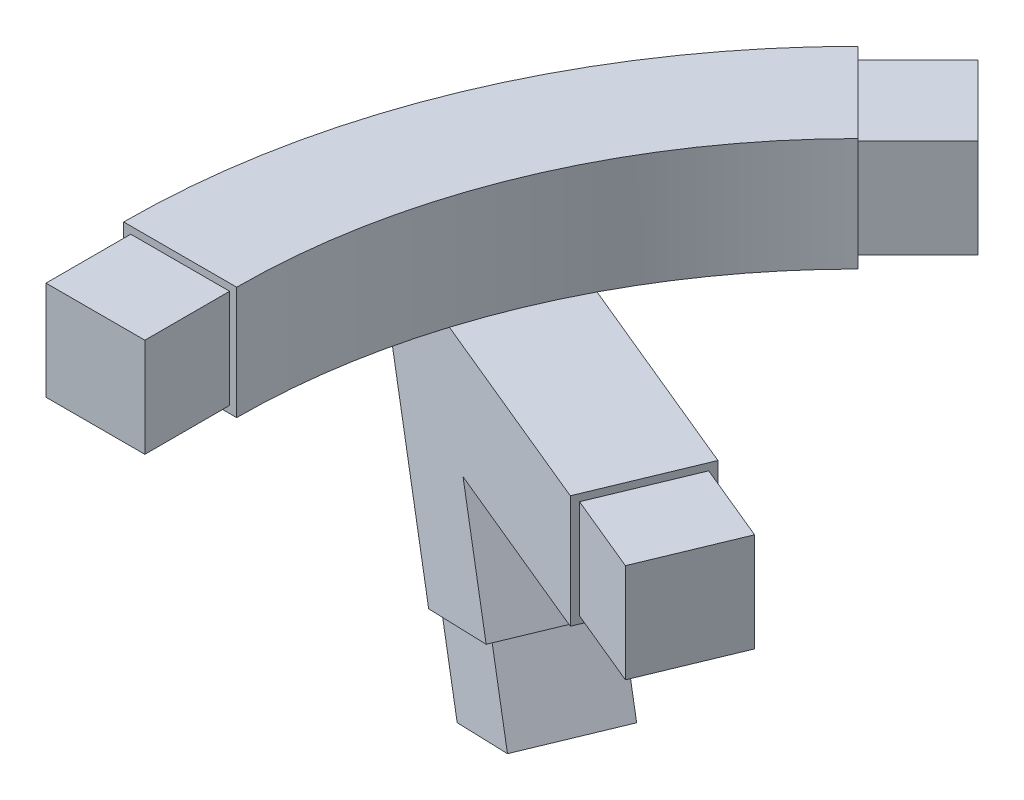
from build123d import *

# Parameters (mm, degrees)
BOSS_EXTRUDE1_DEPTH = 25.4
BOSS_EXTRUDE2_DEPTH = 12.7
SKETCH3_W           = 22.225
SKETCH3_H           = 22.225
BOSS_EXTRUDE3_DEPTH = 19.05
SKETCH4_W           = 22.225
SKETCH4_H           = 22.225
BOSS_EXTRUDE4_DEPTH = 19.05
SKETCH5_W           = 22.225
SKETCH5_H           = 22.225
BOSS_EXTRUDE5_DEPTH = 19.05
BOSS_EXTRUDE6_DEPTH = 19.05
CUT_EXTRUDE1_DEPTH  = 580.024222363


with BuildPart() as part:
    # Sketch1 → Boss-Extrude1 (new body)
    with BuildSketch(Plane(origin=(0, 0, 0), x_dir=(1, 0, 0), z_dir=(0, 1, 0))):
        with BuildLine():
            ThreePointArc((-476.965634664, 139.7), (-466.331605355, 193.160875501), (-436.048451995, 238.482817332))
            Line((-436.048451995, 238.482817332), (-454.008964237, 256.443329574))
            ThreePointArc((-454.008964237, 256.443329574), (-489.798145481, 202.881034683), (-502.365634664, 139.7))
            Line((-502.365634664, 139.7), (-476.965634664, 139.7))
        make_face()
    extrude(amount=BOSS_EXTRUDE1_DEPTH)

    # Sketch2 → Boss-Extrude2 (add, symmetric)
    with BuildSketch(Plane(origin=(0, 0, 0), x_dir=(0.9238795325112892, 0, 0.3826834323650839), z_dir=(-0.3826834323650839, 0, 0.9238795325112892))):
        Polygon((-530.153692386, 0), (-530.153692386, -12.7), (-512.779069106, -60.436385136), (-488.910876538, -51.749073495), (-498.50115499, -25.4), (-453.953692386, -25.4), (-453.953692386, 0), align=None)
    extrude(amount=BOSS_EXTRUDE2_DEPTH, both=True)

    # Sketch3 → Boss-Extrude3 (add)
    with BuildSketch(Plane.XY.offset(-139.7)):
        with Locations((-489.665634664, 12.7)):
            Rectangle(SKETCH3_W, SKETCH3_H)
    extrude(amount=BOSS_EXTRUDE3_DEPTH)

    # Sketch4 → Boss-Extrude4 (add)
    with BuildSketch(Plane(origin=(-98.782817332, 0, 98.782817332), x_dir=(-0.7071067811865343, 0, -0.7071067811865608), z_dir=(0.7071067811865608, 0, -0.7071067811865343))):
        with Locations((489.665634664, 12.7)):
            Rectangle(SKETCH4_W, SKETCH4_H)
    extrude(amount=BOSS_EXTRUDE4_DEPTH)

    # Sketch5 → Boss-Extrude5 (add)
    with BuildSketch(Plane(origin=(-419.398525104, 0, -173.720557137), x_dir=(0.3826834323650839, 0, -0.9238795325112892), z_dir=(0.9238795325112892, 0, 0.3826834323650839))):
        with Locations((0, -12.7)):
            Rectangle(SKETCH5_W, SKETCH5_H)
    extrude(amount=BOSS_EXTRUDE5_DEPTH)

    # Sketch6 → Boss-Extrude6 (add)
    with BuildSketch(Plane(origin=(-37.4724398, 111.437344998, -15.52159278), x_dir=(0.9487640489542349, 0.3129641753372822, -0.043591333627466894), z_dir=(0.31598541012516107, -0.9396926207859091, 0.13088544238586405))):
        Polygon((-462.863246728, -191.884470829), (-453.898805786, -212.221368911), (-433.561907704, -203.25692797), (-442.526348645, -182.920029887), align=None)
    extrude(amount=BOSS_EXTRUDE6_DEPTH)

    # Sketch7 → Cut-Extrude1 (cut, through all)
    with BuildSketch(Plane(origin=(0, 25.4, 0), x_dir=(1, 0, 0), z_dir=(0, 1, 0))):
        with BuildLine():
            ThreePointArc((-494.206275899, 190.960561143), (-492.116958141, 196.963230937), (-489.798145481, 202.881034683))
            Line((-489.798145481, 202.881034683), (-494.658225072, 191.147764621))
            Line((-494.658225072, 191.147764621), (-494.206275899, 190.960561143))
        make_face()
        with BuildLine():
            Line((-484.486116716, 214.427101269), (-484.93806589, 214.614304746))
            Line((-484.93806589, 214.614304746), (-489.798145481, 202.881034683))
            ThreePointArc((-489.798145481, 202.881034683), (-487.253274478, 208.705201999), (-484.486116716, 214.427101269))
        make_face()
    extrude(amount=-CUT_EXTRUDE1_DEPTH, mode=Mode.SUBTRACT)


solid = part.part
